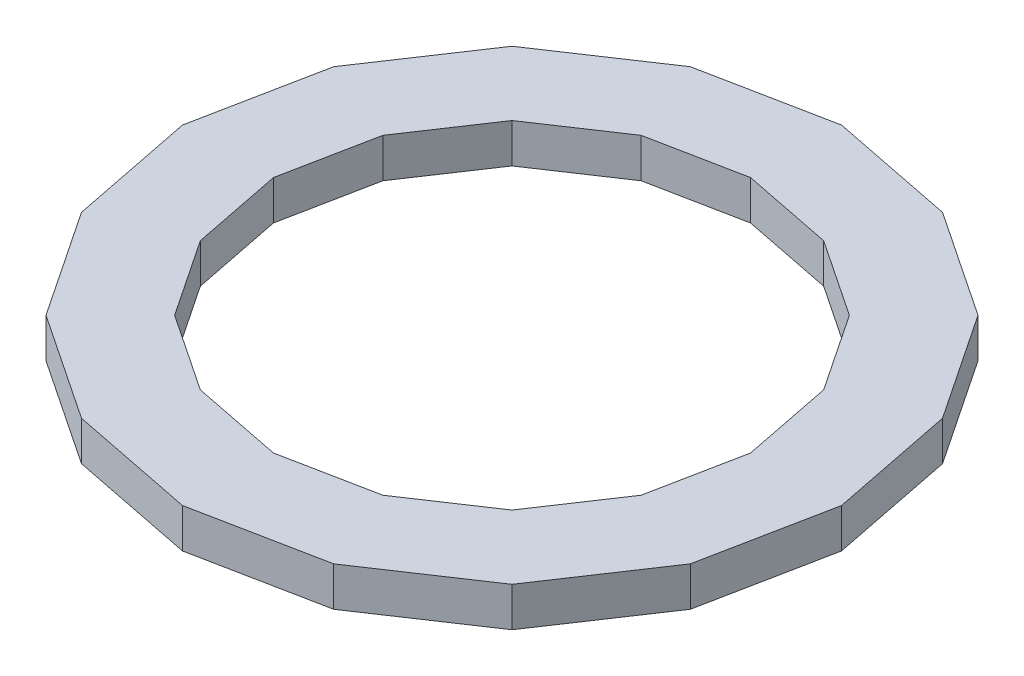
from build123d import *

# Parameters (mm, degrees)
BOSS_EXTRUDE1_DEPTH = 19.05


with BuildPart() as part:
    # Sketch1 → Boss-Extrude1 (new body)
    with BuildSketch(Plane(origin=(0, 0, 0), x_dir=(1, 0, 0), z_dir=(0, 1, 0))):
        Polygon((159.490228313, 0), (147.349757574, 61.034267999), (112.776621973, 112.776621973), (61.034267999, 147.349757574), (0, 159.490228313), (-61.034267999, 147.349757574), (-112.776621973, 112.776621973), (-147.349757574, 61.034267999), (-159.490228313, 0), (-147.349757574, -61.034267999), (-112.776621973, -112.776621973), (-61.034267999, -147.349757574), (0, -159.490228313), (61.034267999, -147.349757574), (112.776621973, -112.776621973), (147.349757574, -61.034267999), align=None)
        Polygon((115.464282102, 0), (106.67508697, 44.18626779), (81.645576859, 81.645576859), (44.18626779, 106.67508697), (0, 115.464282102), (-44.18626779, 106.67508697), (-81.645576859, 81.645576859), (-106.67508697, 44.18626779), (-115.464282102, 0), (-106.67508697, -44.18626779), (-81.645576859, -81.645576859), (-44.18626779, -106.67508697), (0, -115.464282102), (44.18626779, -106.67508697), (81.645576859, -81.645576859), (106.67508697, -44.18626779), align=None, mode=Mode.SUBTRACT)
    extrude(amount=BOSS_EXTRUDE1_DEPTH)


solid = part.part
